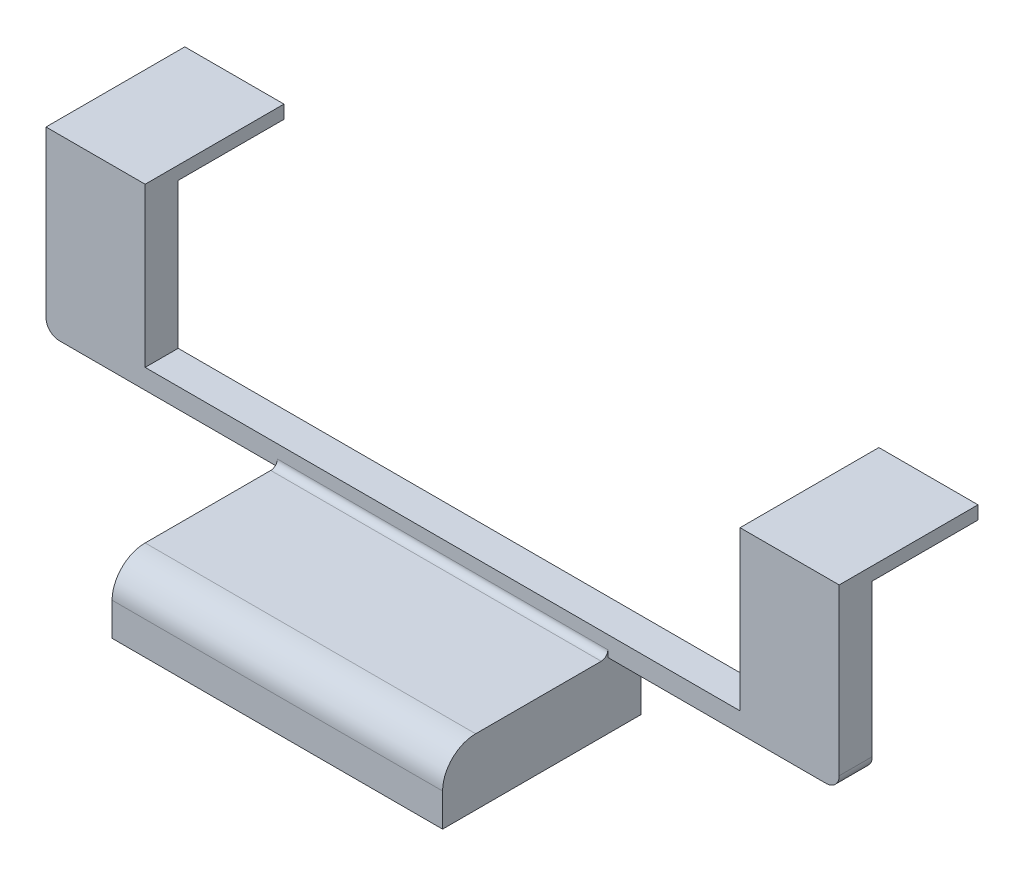
from build123d import *

# Parameters (mm, degrees)
SKETCH_1_W          = 120
SKETCH_1_H          = 5
EXTRUDE_1_DEPTH     = 3
SKETCH_2_W          = 15
SKETCH_2_H          = 5
EXTRUDE_2_DEPTH     = 24
SKETCH_3_W          = 50
SKETCH_3_H          = 30
EXTRUDE_3_DEPTH     = 10
FILLET_6_R          = 1
FILLET_7_R          = 5
FILLET_9_R          = 2
FILLET_10_R         = 2
CUT_EXTRUDE_1_DEPTH = 8
SKETCH_5_W          = 15
SKETCH_5_H          = 2
EXTRUDE_4_DEPTH     = 16


with BuildPart() as part:
    # 草图1 → 凸台-拉伸1 (new body)
    with BuildSketch(Plane(origin=(0, 0, 0), x_dir=(1, 0, 0), z_dir=(0, 1, 0))):
        with Locations((4.226022422, -28.977588204)):
            Rectangle(SKETCH_1_W, SKETCH_1_H)
    extrude(amount=EXTRUDE_1_DEPTH)

    # 草图2 → 凸台-拉伸2 (add)
    with BuildSketch(Plane(origin=(0, 3, 0), x_dir=(1, 0, 0), z_dir=(0, 1, 0))):
        with Locations((-48.273977578, -28.977588204)):
            Rectangle(SKETCH_2_W, SKETCH_2_H)
        with Locations((56.726022422, -28.977588204)):
            Rectangle(SKETCH_2_W, SKETCH_2_H)
    extrude(amount=EXTRUDE_2_DEPTH)

    # 草图3 → 凸台-拉伸3 (add)
    with BuildSketch(Plane.XZ):
        with Locations((4.226022422, 41.477588204)):
            Rectangle(SKETCH_3_W, SKETCH_3_H)
    extrude(amount=EXTRUDE_3_DEPTH)

    # 圆角6
    fillet_6_edges = [part.edges().sort_by_distance(p)[0] for p in [
        (4.226022422, 0, 31.477588204),
    ]]
    fillet(fillet_6_edges, radius=FILLET_6_R)

    # 圆角7
    fillet_7_edges = [part.edges().sort_by_distance(p)[0] for p in [
        (4.226022422, 0, 56.477588204),
    ]]
    fillet(fillet_7_edges, radius=FILLET_7_R)

    # 圆角9
    fillet_9_edges = [part.edges().sort_by_distance(p)[0] for p in [
        (64.226022422, 0, 28.977588204),
    ]]
    fillet(fillet_9_edges, radius=FILLET_9_R)

    # 圆角10
    fillet_10_edges = [part.edges().sort_by_distance(p)[0] for p in [
        (-55.773977578, 0, 28.977588204),
    ]]
    fillet(fillet_10_edges, radius=FILLET_10_R)

    # 草图4 → 切除-拉伸1 (cut)
    with BuildSketch(Plane.XZ.offset(10)):
        with BuildLine():
            ThreePointArc((-4.093422023, 38.044390841), (4.226022422, 32.477588204), (12.545466866, 38.044390841))
            ThreePointArc((12.545466866, 38.044390841), (16.726022422, 41.477588204), (12.545466866, 44.910785567))
            ThreePointArc((12.545466866, 44.910785567), (4.226022422, 50.477588204), (-4.093422023, 44.910785567))
            ThreePointArc((-4.093422023, 44.910785567), (-8.273977578, 41.477588204), (-4.093422023, 38.044390841))
        make_face()
    extrude(amount=-CUT_EXTRUDE_1_DEPTH, mode=Mode.SUBTRACT)

    # 草图5 → 凸台-拉伸4 (add)
    with BuildSketch(Plane(origin=(0, 0, 26.477588204), x_dir=(-1, 0, 0), z_dir=(0, 0, -1))):
        with Locations((-56.726022422, 26)):
            Rectangle(SKETCH_5_W, SKETCH_5_H)
        with Locations((48.273977578, 26)):
            Rectangle(SKETCH_5_W, SKETCH_5_H)
    extrude(amount=EXTRUDE_4_DEPTH)


solid = part.part
